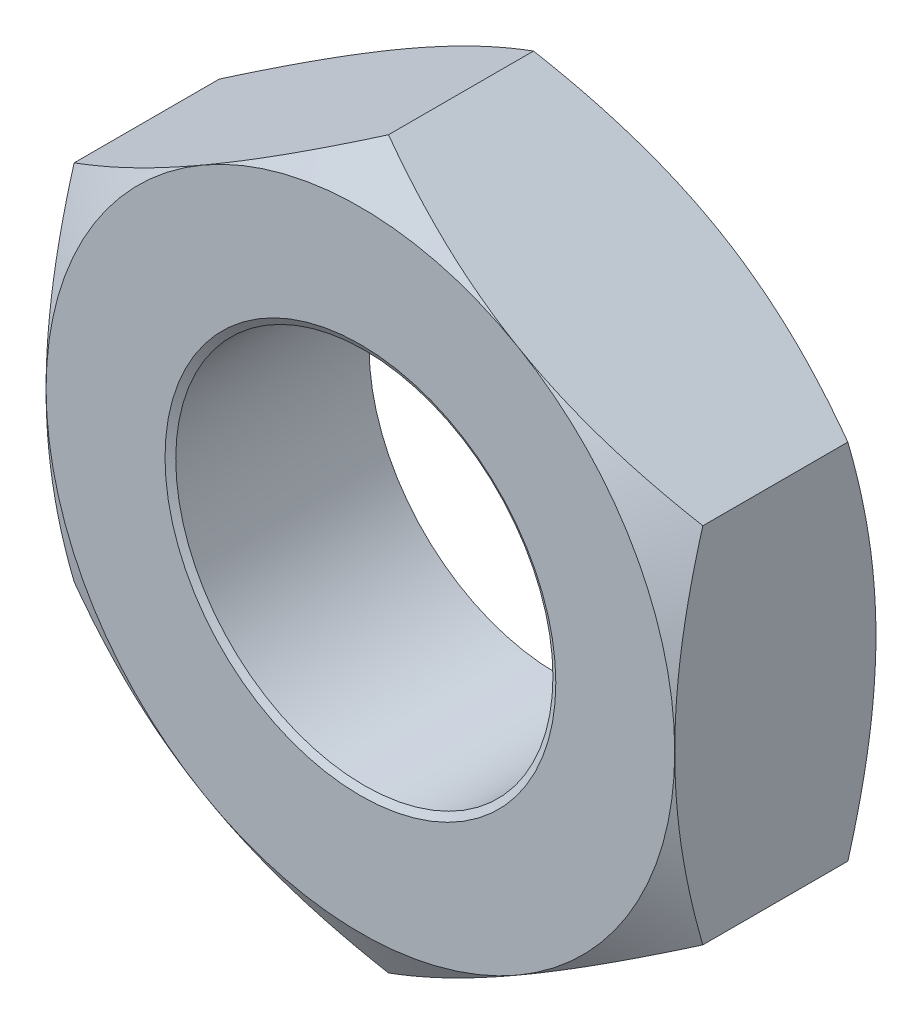
from build123d import *

# Parameters (mm, degrees)
SKETCH3_R                    = 3
BOSS_EXTRUDE1_DEPTH          = 1.6
SKETCH4_OUTSIDE_W            = 49.762
SKETCH4_OUTSIDE_H            = 51.31
SKETCH4_OUTSIDE_R            = 5
CUT_EXTRUDE1_DEPTH           = 10
CUT_EXTRUDE1_DRAFT           = -60
SKETCH4_OUTSIDE_R_2          = 3.108253175
CUT_EXTRUDE1_PROFILE_2_DEPTH = 10
CUT_EXTRUDE1_PROFILE_2_DRAFT = -60
MIRROR1_COPY_1_SKETCH_W      = 49.762
MIRROR1_COPY_1_SKETCH_H      = 51.31
MIRROR1_COPY_1_SKETCH_R      = 5
MIRROR1_COPY_1_DEPTH         = 10
MIRROR1_COPY_1_DRAFT         = -60
MIRROR1_COPY_2_SKETCH_R      = 3.108253175
MIRROR1_COPY_2_DEPTH         = 10
MIRROR1_COPY_2_DRAFT         = -60
MIRROR1_COPY_3_SKETCH_R      = 3.108253175
MIRROR1_COPY_3_DEPTH         = 10
MIRROR1_COPY_3_DRAFT         = -60


with BuildPart() as part:
    # Sketch3 → Boss-Extrude1 (new, symmetric)
    with BuildSketch(Plane.XY):
        Polygon((-5, 2.886751346), (-5, -2.886751346), (0, -5.773502692), (5, -2.886751346), (5, 2.886751346), (0, 5.773502692), align=None)
        Circle(SKETCH3_R, mode=Mode.SUBTRACT)
    extrude(amount=BOSS_EXTRUDE1_DEPTH, both=True)


with BuildPart() as cut_extrude1_tool:
    # Sketch4 outside → Cut-Extrude1 (with draft: the straight prism first)
    with BuildSketch(Plane.XY.offset(1.6)):
        Rectangle(SKETCH4_OUTSIDE_W, SKETCH4_OUTSIDE_H)
        Circle(SKETCH4_OUTSIDE_R, mode=Mode.SUBTRACT)
    extrude(amount=-CUT_EXTRUDE1_DEPTH)
    # Cut-Extrude1: the draft: its side faces are tilted about the plane it starts from
    cut_extrude1_sides = [cut_extrude1_tool.faces().sort_by_distance(p)[0] for p in [
        (0, -25.655, -3.4),
        (24.881, 0, -3.4),
        (0, 25.655, -3.4),
        (-24.881, 0, -3.4),
        (-5, 0, -3.4),
    ]]
    draft(cut_extrude1_sides, Plane.XY.offset(1.6), CUT_EXTRUDE1_DRAFT)


with BuildPart() as part_1:
    add(part.part)

    # Cut-Extrude1: cut by cut_extrude1_tool
    add(cut_extrude1_tool.part, mode=Mode.SUBTRACT)


with BuildPart() as cut_extrude1_profile_2_tool:
    # Sketch4 outside → Cut-Extrude1 profile 2 (with draft: the straight prism first)
    with BuildSketch(Plane.XY.offset(1.6)):
        Circle(SKETCH4_OUTSIDE_R_2)
    extrude(amount=-CUT_EXTRUDE1_PROFILE_2_DEPTH)
    # Cut-Extrude1 profile 2: the draft: its side faces are tilted about the plane it starts from
    cut_extrude1_profile_2_sides = [cut_extrude1_profile_2_tool.faces().sort_by_distance(p)[0] for p in [
        (-3.108253175, 0, -3.4),
    ]]
    draft(cut_extrude1_profile_2_sides, Plane.XY.offset(1.6), CUT_EXTRUDE1_PROFILE_2_DRAFT)


with BuildPart() as part_2:
    add(part_1.part)

    # Cut-Extrude1 profile 2: cut by cut_extrude1_profile_2_tool
    add(cut_extrude1_profile_2_tool.part, mode=Mode.SUBTRACT)


with BuildPart() as mirror1_copy_1_tool:
    # Mirror1 copy 1 sketch → Mirror1 copy 1 (with draft: the straight prism first)
    with BuildSketch(Plane(origin=(0, 0, -1.6), x_dir=(1, 0, 0), z_dir=(0, 0, -1))):
        Rectangle(MIRROR1_COPY_1_SKETCH_W, MIRROR1_COPY_1_SKETCH_H)
        Circle(MIRROR1_COPY_1_SKETCH_R, mode=Mode.SUBTRACT)
    extrude(amount=-MIRROR1_COPY_1_DEPTH)
    # Mirror1 copy 1: the draft: its side faces are tilted about the plane it starts from
    mirror1_copy_1_sides = [mirror1_copy_1_tool.faces().sort_by_distance(p)[0] for p in [
        (0, -25.655, 3.4),
        (24.881, 0, 3.4),
        (0, 25.655, 3.4),
        (-24.881, 0, 3.4),
        (-5, 0, 3.4),
    ]]
    draft(mirror1_copy_1_sides, Plane(origin=(0, 0, -1.6), x_dir=(1, 0, 0), z_dir=(0, 0, -1)), MIRROR1_COPY_1_DRAFT)


with BuildPart() as part_3:
    add(part_2.part)

    # Mirror1 copy 1: cut by mirror1_copy_1_tool
    add(mirror1_copy_1_tool.part, mode=Mode.SUBTRACT)


with BuildPart() as mirror1_copy_2_tool:
    # Mirror1 copy 2 sketch → Mirror1 copy 2 (with draft: the straight prism first)
    with BuildSketch(Plane(origin=(0, 0, -1.6), x_dir=(1, 0, 0), z_dir=(0, 0, -1))):
        Circle(MIRROR1_COPY_2_SKETCH_R)
    extrude(amount=-MIRROR1_COPY_2_DEPTH)
    # Mirror1 copy 2: the draft: its side faces are tilted about the plane it starts from
    mirror1_copy_2_sides = [mirror1_copy_2_tool.faces().sort_by_distance(p)[0] for p in [
        (-3.108253175, 0, 3.4),
    ]]
    draft(mirror1_copy_2_sides, Plane(origin=(0, 0, -1.6), x_dir=(1, 0, 0), z_dir=(0, 0, -1)), MIRROR1_COPY_2_DRAFT)


with BuildPart() as part_4:
    add(part_3.part)

    # Mirror1 copy 2: cut by mirror1_copy_2_tool
    add(mirror1_copy_2_tool.part, mode=Mode.SUBTRACT)


with BuildPart() as mirror1_copy_3_tool:
    # Mirror1 copy 3 sketch → Mirror1 copy 3 (with draft: the straight prism first)
    with BuildSketch(Plane(origin=(0, 0, -1.6), x_dir=(1, 0, 0), z_dir=(0, 0, -1))):
        Circle(MIRROR1_COPY_3_SKETCH_R)
    extrude(amount=-MIRROR1_COPY_3_DEPTH)
    # Mirror1 copy 3: the draft: its side faces are tilted about the plane it starts from
    mirror1_copy_3_sides = [mirror1_copy_3_tool.faces().sort_by_distance(p)[0] for p in [
        (-3.108253175, 0, 3.4),
    ]]
    draft(mirror1_copy_3_sides, Plane(origin=(0, 0, -1.6), x_dir=(1, 0, 0), z_dir=(0, 0, -1)), MIRROR1_COPY_3_DRAFT)


with BuildPart() as part_5:
    add(part_4.part)

    # Mirror1 copy 3: cut by mirror1_copy_3_tool
    add(mirror1_copy_3_tool.part, mode=Mode.SUBTRACT)


solid = part_5.part
